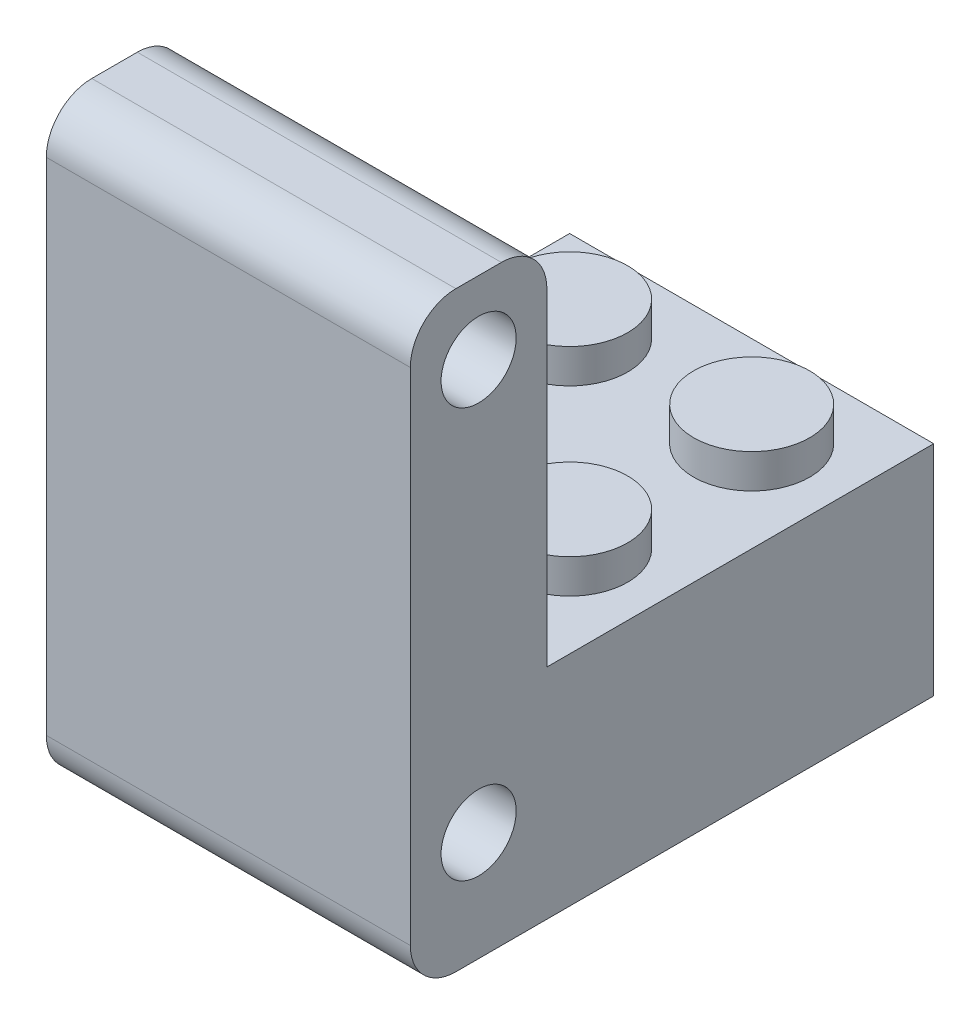
from build123d import *

# Parameters (mm, degrees)
SKETCH1_R           = 1.65
BOSS_EXTRUDE1_DEPTH = 16
SKETCH2_R           = 2.55
BOSS_EXTRUDE2_DEPTH = 1.5
FILLET1_R           = 2


with BuildPart() as part:
    # Sketch1 → Boss-Extrude1 (new body)
    with BuildSketch(Plane(origin=(76, 0, 0), x_dir=(0, 0, -1), z_dir=(1, 0, 0))):
        Polygon((-39.367141304, -29.396728555), (-62.367141304, -29.396728555), (-62.367141304, -3.396728555), (-56.367141304, -3.396728555), (-56.367141304, -19.796728555), (-39.367141304, -19.796728555), align=None)
        with Locations(Location((-59.367141305, -24.59672823, 0), (0, 0, 90))):
            Circle(SKETCH1_R, mode=Mode.SUBTRACT)
        with Locations(Location((-59.367141305, -6.59672823, 0), (0, 0, 90))):
            Circle(SKETCH1_R, mode=Mode.SUBTRACT)
    extrude(amount=-BOSS_EXTRUDE1_DEPTH)

    # Sketch2 → Boss-Extrude2 (add)
    with BuildSketch(Plane(origin=(0, -19.796728555, 0), x_dir=(1, 0, 0), z_dir=(0, 1, 0))):
        with Locations(Location((64, -51.367141304, 0), (0, 0, 270))):
            Circle(SKETCH2_R)
        with Locations(Location((64, -43.367141304, 0), (0, 0, 270))):
            Circle(SKETCH2_R)
        with Locations(Location((72, -43.367141304, 0), (0, 0, 270))):
            Circle(SKETCH2_R)
        with Locations(Location((72, -51.367141304, 0), (0, 0, 270))):
            Circle(SKETCH2_R)
    extrude(amount=BOSS_EXTRUDE2_DEPTH)

    # Fillet1
    fillet1_edges = [part.edges().sort_by_distance(p)[0] for p in [
        (68, -29.396728555, 62.367141304),
        (68, -3.396728555, 62.367141304),
        (68, -3.396728555, 56.367141304),
    ]]
    fillet(fillet1_edges, radius=FILLET1_R)


solid = part.part
